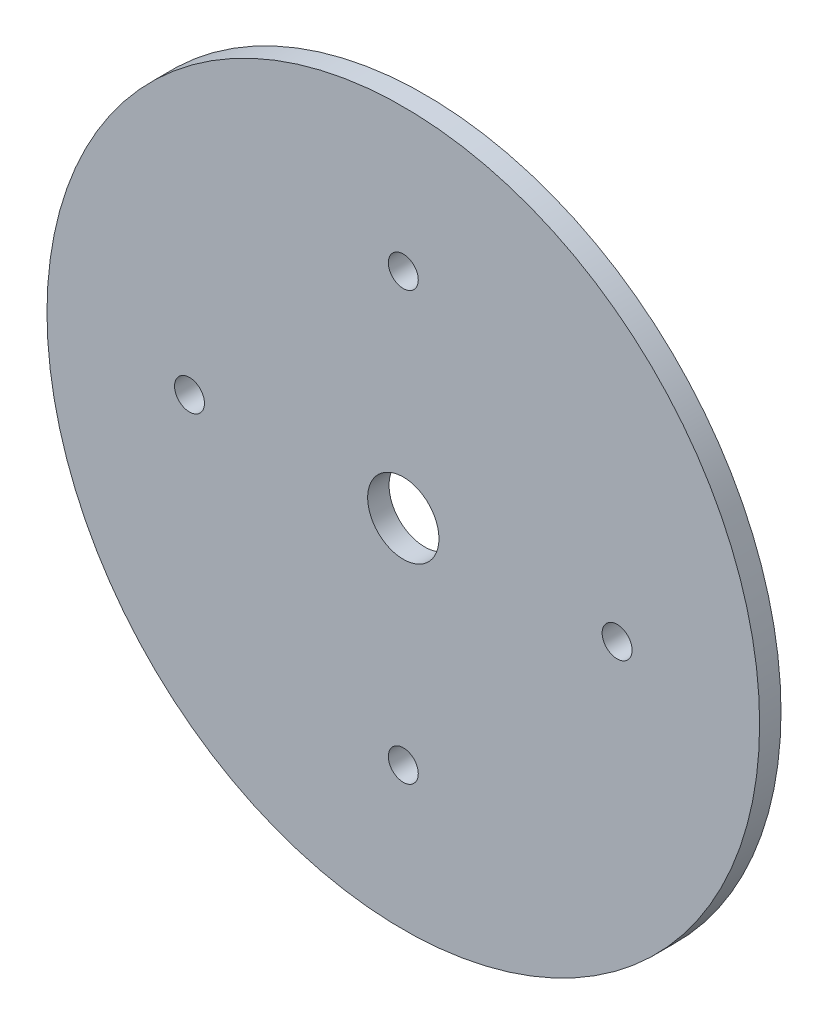
from build123d import *

# Parameters (mm, degrees)
SKETCH1_R           = 50
SKETCH1_R_2         = 5
SKETCH1_R_3         = 2.1
BOSS_EXTRUDE1_DEPTH = 3


with BuildPart() as part:
    # Sketch1 → Boss-Extrude1 (new body)
    with BuildSketch(Plane.XY):
        Circle(SKETCH1_R)
        Circle(SKETCH1_R_2, mode=Mode.SUBTRACT)
        with Locations((0, -30)):
            Circle(SKETCH1_R_3, mode=Mode.SUBTRACT)
        with Locations((-30, 0)):
            Circle(SKETCH1_R_3, mode=Mode.SUBTRACT)
        with Locations((0, 30)):
            Circle(SKETCH1_R_3, mode=Mode.SUBTRACT)
        with Locations((30, 0)):
            Circle(SKETCH1_R_3, mode=Mode.SUBTRACT)
    extrude(amount=BOSS_EXTRUDE1_DEPTH)


solid = part.part
